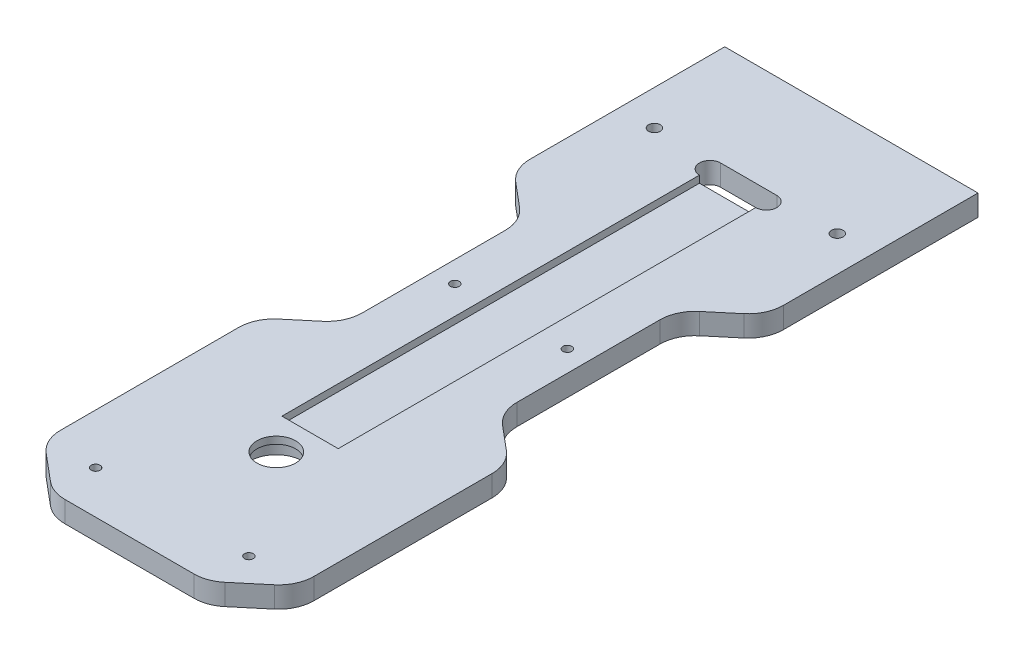
from build123d import *

# Parameters (mm, degrees)
BOSS_EXTRUDE1_DEPTH = 6
FILLET1_R           = 10
SKETCH2_R           = 2.5
CUT_EXTRUDE1_DEPTH  = 6
SKETCH5_R           = 7.5
CUT_EXTRUDE3_DEPTH  = 4
SKETCH6_R           = 5.5
CUT_EXTRUDE4_DEPTH  = 4
SKETCH8_W           = 16
SKETCH8_H           = 121.699623713
CUT_EXTRUDE5_DEPTH  = 2
FILLET2_R           = 10
CUT_EXTRUDE6_DEPTH  = 10
SKETCH10_R          = 1.25
CUT_EXTRUDE7_DEPTH  = 10
SKETCH11_R          = 1.25
CUT_EXTRUDE8_DEPTH  = 10
SKETCH12_R          = 1.65
CUT_EXTRUDE9_DEPTH  = 10


with BuildPart() as part:
    # Sketch1 → Boss-Extrude1 (new body)
    with BuildSketch(Plane(origin=(0, 0, 0), x_dir=(1, 0, 0), z_dir=(0, 1, 0))):
        Polygon((21.213083016, -102.227633762), (35.213083016, -90.480238926), (35.213083016, -30.480238926), (21.213083016, -18.73284409), (21.213083016, 31.26715591), (35.213083016, 43.014550747), (35.213083016, 103.014550747), (-36.786916984, 103.014550747), (-36.786916984, 43.014550747), (-22.786916984, 31.26715591), (-22.786916984, -18.73284409), (-36.786916984, -30.480238926), (-36.786916984, -90.480238926), (-22.786916984, -102.227633762), align=None)
    extrude(amount=BOSS_EXTRUDE1_DEPTH)

    # Fillet1
    fillet1_edges = [part.edges().sort_by_distance(p)[0] for p in [
        (-22.786916984, 3, 102.227633762),
        (-36.786916984, 3, 90.480238926),
        (-36.786916984, 3, 30.480238926),
        (-22.786916984, 3, 18.73284409),
        (21.213083016, 3, 18.73284409),
        (35.213083016, 3, 30.480238926),
        (35.213083016, 3, 90.480238926),
        (21.213083016, 3, 102.227633762),
    ]]
    fillet(fillet1_edges, radius=FILLET1_R)

    # Sketch2 → Cut-Extrude1 (cut)
    with BuildSketch(Plane.XZ):
        with Locations(Location((-0.786916984, 60.480238926, 0), (0, 0, 270))):
            Circle(SKETCH2_R)
    extrude(amount=-CUT_EXTRUDE1_DEPTH, mode=Mode.SUBTRACT)

    # Sketch5 → Cut-Extrude3 (cut)
    with BuildSketch(Plane.XZ):
        with Locations(Location((-0.786916984, 60.480238926, 0), (0, 0, 270))):
            Circle(SKETCH5_R)
    extrude(amount=-CUT_EXTRUDE3_DEPTH, mode=Mode.SUBTRACT)

    # Sketch6 → Cut-Extrude4 (cut)
    with BuildSketch(Plane.XZ.offset(-4)):
        with Locations(Location((-0.786916984, 60.480238926, 0), (0, 0, 270))):
            Circle(SKETCH6_R)
    extrude(amount=-CUT_EXTRUDE4_DEPTH, mode=Mode.SUBTRACT)

    # Sketch8 → Cut-Extrude5 (cut)
    with BuildSketch(Plane(origin=(0, 6, 0), x_dir=(1, 0, 0), z_dir=(0, 1, 0))):
        with Locations((-0.786916984, 9.974259286)):
            Rectangle(SKETCH8_W, SKETCH8_H)
    extrude(amount=-CUT_EXTRUDE5_DEPTH, mode=Mode.SUBTRACT)

    # Fillet2
    fillet2_edges = [part.edges().sort_by_distance(p)[0] for p in [
        (-22.786916984, 3, -31.26715591),
        (-36.786916984, 3, -43.014550747),
        (35.213083016, 3, -43.014550747),
        (21.213083016, 3, -31.26715591),
    ]]
    fillet(fillet2_edges, radius=FILLET2_R)

    # Sketch9 → Cut-Extrude6 (cut)
    with BuildSketch(Plane(origin=(0, 6, 0), x_dir=(1, 0, 0), z_dir=(0, 1, 0))):
        with BuildLine():
            Line((7.213083016, 67.824071143), (-8.786916984, 67.824071143))
            ThreePointArc((-8.786916984, 67.824071143), (-11.786916984, 70.824071143), (-8.786916984, 73.824071143))
            Line((-8.786916984, 73.824071143), (7.213083016, 73.824071143))
            ThreePointArc((7.213083016, 73.824071143), (10.213083016, 70.824071143), (7.213083016, 67.824071143))
        make_face()
    extrude(amount=-CUT_EXTRUDE6_DEPTH, mode=Mode.SUBTRACT)

    # Sketch10 → Cut-Extrude7 (cut)
    with BuildSketch(Plane.XZ):
        with Locations(Location((-16.786916984, -6.26715591, 0), (0, 0, 270))):
            Circle(SKETCH10_R)
        with Locations(Location((15.213083016, -6.26715591, 0), (0, 0, 270))):
            Circle(SKETCH10_R)
    extrude(amount=-CUT_EXTRUDE7_DEPTH, mode=Mode.SUBTRACT)

    # Sketch11 → Cut-Extrude8 (cut)
    with BuildSketch(Plane(origin=(0, 6, 0), x_dir=(1, 0, 0), z_dir=(0, 1, 0))):
        with Locations(Location((20.993582106, -90.043344962, 0), (0, 0, 270))):
            Circle(SKETCH11_R)
        with Locations(Location((-22.567416075, -90.043344962, 0), (0, 0, 270))):
            Circle(SKETCH11_R)
    extrude(amount=-CUT_EXTRUDE8_DEPTH, mode=Mode.SUBTRACT)

    # Sketch12 → Cut-Extrude9 (cut)
    with BuildSketch(Plane(origin=(0, 6, 0), x_dir=(1, 0, 0), z_dir=(0, 1, 0))):
        with Locations(Location((25.213083016, 73.014550747, 0), (0, 0, 270))):
            Circle(SKETCH12_R)
        with Locations(Location((-26.786916984, 73.014550747, 0), (0, 0, 270))):
            Circle(SKETCH12_R)
    extrude(amount=-CUT_EXTRUDE9_DEPTH, mode=Mode.SUBTRACT)


solid = part.part
